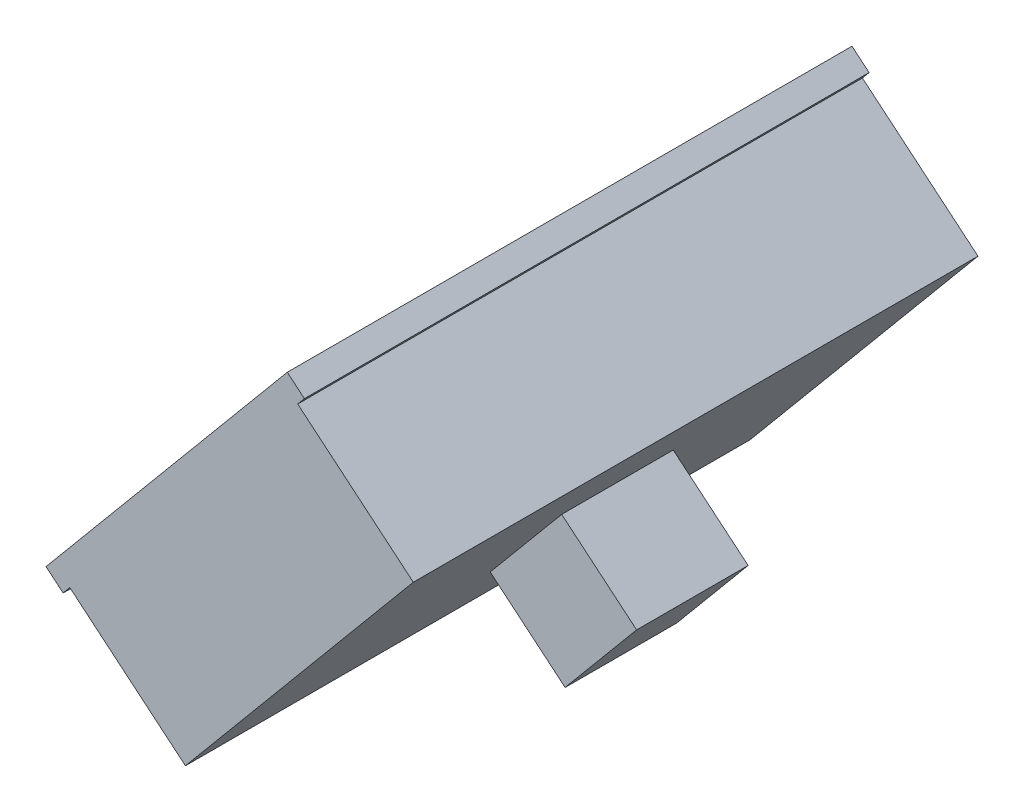
from build123d import *

# Parameters (mm, degrees)
MB_DEPTH    = 40.5
CAM_DEPTH   = 40.5
LENTE_DEPTH = 8


with BuildPart() as part:
    # Croquis_mb → MB (new body)
    with BuildSketch(Plane.XY.offset(-128.1)):
        Polygon((-123.543957493, 167.071730093), (-106.238601826, 187.796706939), (-105.01045505, 186.771204381), (-122.315810717, 166.046227535), align=None)
    extrude(amount=MB_DEPTH)

    # Croquis_cam → CAM (add)
    with BuildSketch(Plane.XY.offset(-128.1)):
        Polygon((-121.835106393, 166.621921336), (-105.491159374, 186.195510579), (-97.201168636, 179.273368313), (-113.545115654, 159.69977907), align=None)
    extrude(amount=CAM_DEPTH)

    # Croquis_lente → Lente (add)
    with BuildSketch(Plane.XY.offset(-103.85)):
        Polygon((-107.93689854, 166.416206751), (-102.80938575, 172.556940631), (-97.436243605, 168.07036694), (-102.563756395, 161.92963306), align=None)
    extrude(amount=-LENTE_DEPTH)


solid = part.part
